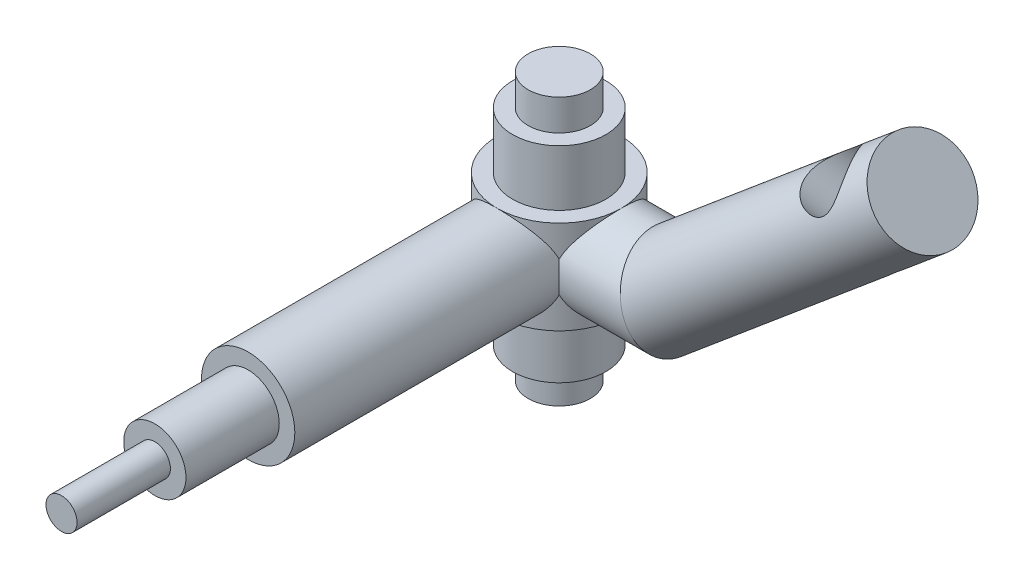
from build123d import *

# Parameters (mm, degrees)
IZIM2_R                     = 5
Y_KSEKLIK_EKSTR_ZYON2_DEPTH = 21.5
IZIM2_5_R                   = 7.5
IZIM2_5_R_2                 = 5
Y_KSEKLIK_EKSTR_ZYON3_DEPTH = 16.5
IZIM18_R                    = 10
Y_KSEKLIK_EKSTR_ZYON6_DEPTH = 7.5
IZIM3_R                     = 7.5
Y_KSEKLIK_EKSTR_ZYON4_DEPTH = 50
S_P_R4_PROFILE_R            = 7.5
IZIM42_R                    = 5
KES_EKSTR_ZYON5_DEPTH       = 10
IZIM43_R                    = 5
Y_KSEKLIK_EKSTR_ZYON7_DEPTH = 15
IZIM44_R                    = 2.5
Y_KSEKLIK_EKSTR_ZYON8_DEPTH = 15


with BuildPart() as part:
    # Çizim2 → Yükseklik-Ekstrüzyon2 (new, symmetric)
    with BuildSketch(Plane(origin=(0, 0, 0), x_dir=(1, 0, 0), z_dir=(0, 1, 0))):
        Circle(IZIM2_R)
    extrude(amount=Y_KSEKLIK_EKSTR_ZYON2_DEPTH, both=True)

    # Çizim2<5> → Yükseklik-Ekstrüzyon3 (add, symmetric)
    with BuildSketch(Plane(origin=(0, 0, 0), x_dir=(1, 0, 0), z_dir=(0, 1, 0))):
        Circle(IZIM2_5_R)
        Circle(IZIM2_5_R_2, mode=Mode.SUBTRACT)
    extrude(amount=Y_KSEKLIK_EKSTR_ZYON3_DEPTH, both=True)

    # Çizim18 → Yükseklik-Ekstrüzyon6 (add, symmetric)
    with BuildSketch(Plane(origin=(0, 0, 0), x_dir=(1, 0, 0), z_dir=(0, 1, 0))):
        Circle(IZIM18_R)
    extrude(amount=Y_KSEKLIK_EKSTR_ZYON6_DEPTH, both=True)

    # Çizim3 → Yükseklik-Ekstrüzyon4 (add)
    with BuildSketch(Plane.XY):
        Circle(IZIM3_R)
    extrude(amount=Y_KSEKLIK_EKSTR_ZYON4_DEPTH)

    # Süpür4: sweep along a path in Çizim22
    with BuildLine(Plane.XY) as s_p_r4_path:
        Line((0, 0), (17.792695878, 0))
        Line((17.792695878, 0), (58.393051363, 34.067743313))
    # Süpür4 profile (on start of the path) → Süpür4 (sweep)
    with BuildSketch(Plane(origin=(0, 0, 0), x_dir=(0, 0, 1), z_dir=(1, 0, 0))):
        Circle(S_P_R4_PROFILE_R)
    sweep(path=s_p_r4_path.line, transition=Transition.RIGHT)

    # Çizim42 → Kes-Ekstrüzyon5 (cut, symmetric)
    with BuildSketch(Plane(origin=(5.513634999, -6.570894318, -4.952333559), x_dir=(0.8267965189633342, 0.3839166530668254, 0.411114971422934), z_dir=(-0.5566703992264205, 0.6634139481689367, 0.500000000000001))):
        with Locations((52.788286905, 21.97481992)):
            Circle(IZIM42_R)
    extrude(amount=KES_EKSTR_ZYON5_DEPTH, both=True, mode=Mode.SUBTRACT)

    # Çizim43 → Yükseklik-Ekstrüzyon7 (add)
    with BuildSketch(Plane.XY.offset(50)):
        Circle(IZIM43_R)
    extrude(amount=Y_KSEKLIK_EKSTR_ZYON7_DEPTH)

    # Çizim44 → Yükseklik-Ekstrüzyon8 (add)
    with BuildSketch(Plane.XY.offset(65)):
        Circle(IZIM44_R)
    extrude(amount=Y_KSEKLIK_EKSTR_ZYON8_DEPTH)


solid = part.part
